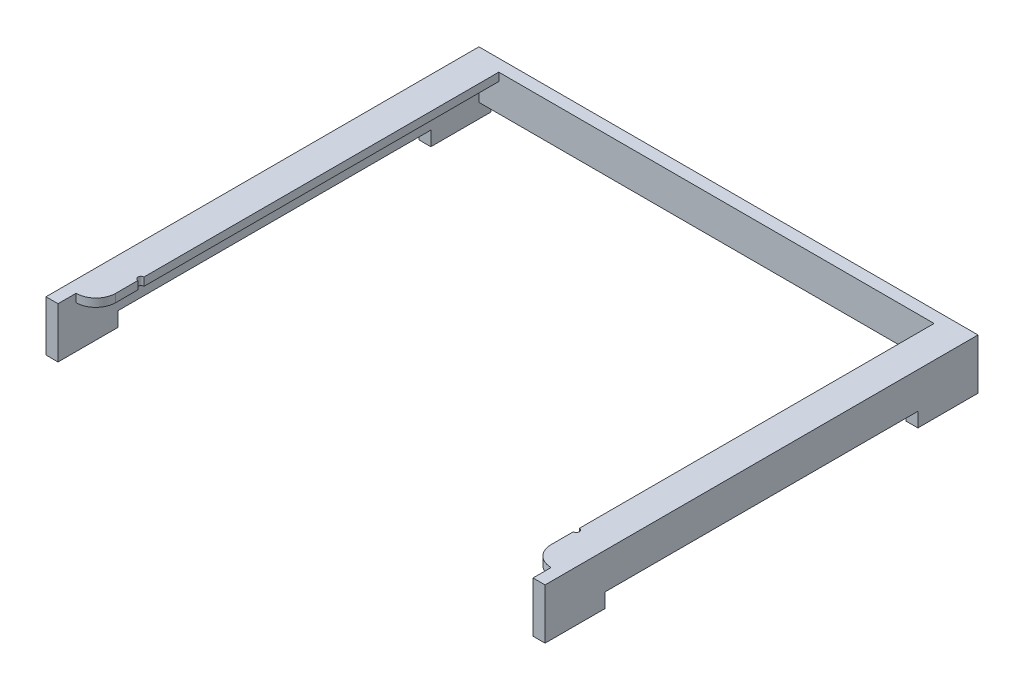
from build123d import *

# Parameters (mm, degrees)
BOSS_EXTRUDE1_DEPTH = 6
BOSS_EXTRUDE2_DEPTH = 1.35
SKETCH3_W           = 2
SKETCH3_H           = 10
BOSS_EXTRUDE3_DEPTH = 2.4


with BuildPart() as part:
    # Sketch1 → Boss-Extrude1 (new body)
    with BuildSketch(Plane(origin=(0, 0, 0), x_dir=(1, 0, 0), z_dir=(0, 1, 0))):
        Polygon((0, 0), (0, 72), (83, 72), (83, 0), (81, 0), (81, 70), (2, 70), (2, 0), align=None)
    extrude(amount=BOSS_EXTRUDE1_DEPTH)

    # Sketch2 → Boss-Extrude2 (add)
    with BuildSketch(Plane(origin=(0, 6, 0), x_dir=(1, 0, 0), z_dir=(0, 1, 0))):
        with BuildLine():
            Line((2, 3), (2, 70))
            Line((2, 70), (5.3, 70))
            Line((5.3, 70), (5.3, 11))
            ThreePointArc((5.3, 11), (4.8, 10.5), (5.3, 10))
            Line((5.3, 10), (5.3, 6.3))
            ThreePointArc((5.3, 6.3), (4.333452378, 3.966547622), (2, 3))
        make_face()
    boss_extrude2 = extrude(amount=-BOSS_EXTRUDE2_DEPTH)

    # Sketch3 → Boss-Extrude3 (add)
    with BuildSketch(Plane.XZ):
        with Locations((1, -5)):
            Rectangle(SKETCH3_W, SKETCH3_H)
        with Locations((1, -67)):
            Rectangle(SKETCH3_W, SKETCH3_H)
    boss_extrude3 = extrude(amount=BOSS_EXTRUDE3_DEPTH)

    # Mirror1: Boss-Extrude2, Boss-Extrude3 across plane
    add(boss_extrude2.mirror(Plane(origin=(41.5, 0, 0), x_dir=(0, 0, 1), z_dir=(1, 0, 0))))
    add(boss_extrude3.mirror(Plane(origin=(41.5, 0, 0), x_dir=(0, 0, 1), z_dir=(1, 0, 0))))


solid = part.part
